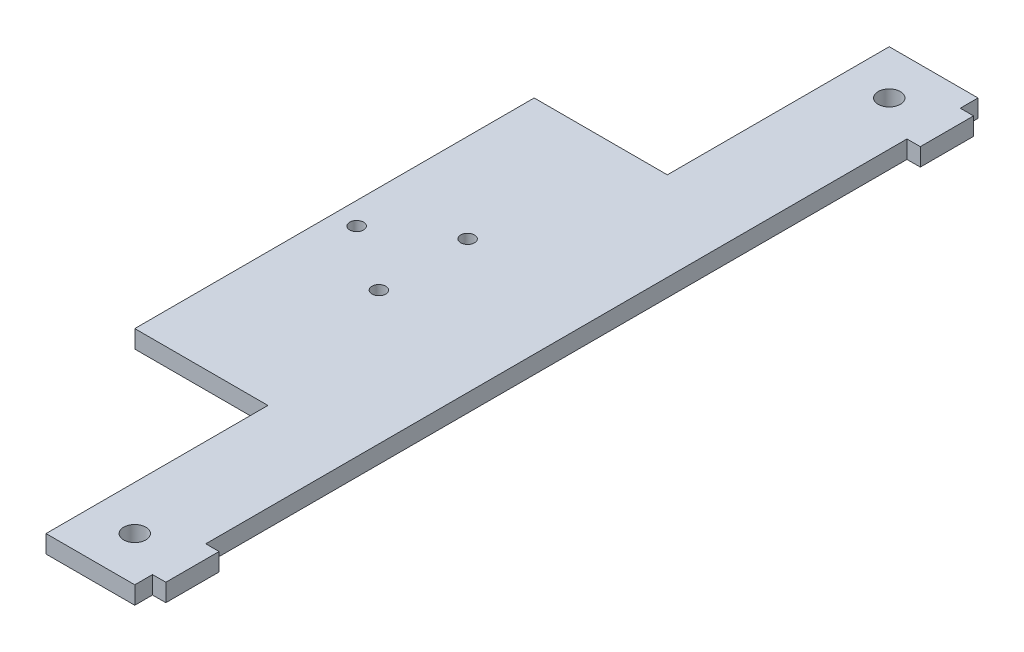
from build123d import *

# Parameters (mm, degrees)
CROQUIS1_W              = 250
CROQUIS1_H              = 250
CROQUIS1_R              = 2.5
SALIENTE_EXTRUIR1_DEPTH = 4
CORTAR_EXTRUIR1_DEPTH   = 4
CROQUIS3_W              = 150
CROQUIS3_H              = 150
CROQUIS3_W_2            = 100
CROQUIS3_H_2            = 100
SALIENTE_EXTRUIR2_DEPTH = 4
CROQUIS4_R              = 1.55
CORTAR_EXTRUIR2_DEPTH   = 10
CROQUIS5_W              = 150
CROQUIS5_H              = 150
CROQUIS5_W_2            = 100
CROQUIS5_H_2            = 100
CORTAR_EXTRUIR3_DEPTH   = 10
CROQUIS6_W              = 30
CROQUIS6_H              = 50
CROQUIS6_W_2            = 50
CROQUIS6_H_2            = 30
CORTAR_EXTRUIR4_DEPTH   = 10
CROQUIS8_R              = 1.55
CORTAR_EXTRUIR5_DEPTH   = 10
CORTAR_EXTRUIR6_DEPTH   = 10


with BuildPart() as part:
    # Croquis1 → Saliente-Extruir1 (new body)
    with BuildSketch(Plane(origin=(0, 0, 0), x_dir=(1, 0, 0), z_dir=(0, 1, 0))):
        with Locations((125, 125)):
            Rectangle(CROQUIS1_W, CROQUIS1_H)
        with Locations(Location((40, 210, 0), (0, 0, 270))):
            Circle(CROQUIS1_R, mode=Mode.SUBTRACT)
        with Locations(Location((210, 210, 0), (0, 0, 270))):
            Circle(CROQUIS1_R, mode=Mode.SUBTRACT)
        with Locations(Location((210, 40, 0), (0, 0, 270))):
            Circle(CROQUIS1_R, mode=Mode.SUBTRACT)
        with Locations(Location((40, 40, 0), (0, 0, 270))):
            Circle(CROQUIS1_R, mode=Mode.SUBTRACT)
    extrude(amount=SALIENTE_EXTRUIR1_DEPTH)

    # Croquis2 → Cortar-Extruir1 (cut)
    with BuildSketch(Plane(origin=(0, 4, 0), x_dir=(1, 0, 0), z_dir=(0, 1, 0))):
        Polygon((50, 50), (200, 50), (200, 200), (50, 200), (50, 150.09044268), align=None)
    extrude(amount=-CORTAR_EXTRUIR1_DEPTH, mode=Mode.SUBTRACT)

    # Croquis3 → Saliente-Extruir2 (add)
    with BuildSketch(Plane(origin=(0, 4, 0), x_dir=(1, 0, 0), z_dir=(0, 1, 0))):
        with Locations((125, 125)):
            Rectangle(CROQUIS3_W, CROQUIS3_H)
        with Locations((125, 125)):
            Rectangle(CROQUIS3_W_2, CROQUIS3_H_2, mode=Mode.SUBTRACT)
    extrude(amount=-SALIENTE_EXTRUIR2_DEPTH)

    # Croquis4 → Cortar-Extruir2 (cut)
    with BuildSketch(Plane(origin=(0, 4, 0), x_dir=(1, 0, 0), z_dir=(0, 1, 0))):
        with Locations(Location((115, 20, 0), (0, 0, 270))):
            Circle(CROQUIS4_R)
        with Locations(Location((135, 20, 0), (0, 0, 270))):
            Circle(CROQUIS4_R)
        with Locations(Location((125, 5, 0), (0, 0, 270))):
            Circle(CROQUIS4_R)
    extrude(amount=-CORTAR_EXTRUIR2_DEPTH, mode=Mode.SUBTRACT)

    # Croquis5 → Cortar-Extruir3 (cut)
    with BuildSketch(Plane(origin=(0, 4, 0), x_dir=(1, 0, 0), z_dir=(0, 1, 0))):
        with Locations((125, 125)):
            Rectangle(CROQUIS5_W, CROQUIS5_H)
        with Locations((125, 125)):
            Rectangle(CROQUIS5_W_2, CROQUIS5_H_2, mode=Mode.SUBTRACT)
    extrude(amount=-CORTAR_EXTRUIR3_DEPTH, mode=Mode.SUBTRACT)

    # Croquis6 → Cortar-Extruir4 (cut)
    with BuildSketch(Plane(origin=(0, 4, 0), x_dir=(1, 0, 0), z_dir=(0, 1, 0))):
        Polygon((170, 0), (250, 0), (250, 30), (220, 30), (170, 30), align=None)
        with Locations((235, 55)):
            Rectangle(CROQUIS6_W, CROQUIS6_H)
        Polygon((0, 80), (0, 0), (30, 0), (30, 30), (30, 80), align=None)
        with Locations((55, 15)):
            Rectangle(CROQUIS6_W_2, CROQUIS6_H_2)
        Polygon((80, 250), (0, 250), (0, 220), (30, 220), (80, 220), align=None)
        with Locations((15, 195)):
            Rectangle(CROQUIS6_W, CROQUIS6_H)
        Polygon((250, 170), (250, 250), (220, 250), (220, 220), (220, 170), align=None)
        with Locations((195, 235)):
            Rectangle(CROQUIS6_W_2, CROQUIS6_H_2)
    extrude(amount=-CORTAR_EXTRUIR4_DEPTH, mode=Mode.SUBTRACT)

    # Croquis8 → Cortar-Extruir5 (cut)
    with BuildSketch(Plane(origin=(0, 4, 0), x_dir=(1, 0, 0), z_dir=(0, 1, 0))):
        with Locations(Location((125, 5, 0), (0, 0, 270))):
            Circle(CROQUIS8_R)
        with Locations(Location((135, 20, 0), (0, 0, 270))):
            Circle(CROQUIS8_R)
        with Locations(Location((115, 20, 0), (0, 0, 270))):
            Circle(CROQUIS8_R)
        with Locations(Location((20, 135, 0), (0, 0, 270))):
            Circle(CROQUIS8_R)
        with Locations(Location((5, 125, 0), (0, 0, 270))):
            Circle(CROQUIS8_R)
        with Locations(Location((20, 115, 0), (0, 0, 270))):
            Circle(CROQUIS8_R)
        with Locations(Location((135, 230, 0), (0, 0, 270))):
            Circle(CROQUIS8_R)
        with Locations(Location((125, 245, 0), (0, 0, 270))):
            Circle(CROQUIS8_R)
        with Locations(Location((115, 230, 0), (0, 0, 270))):
            Circle(CROQUIS8_R)
        with Locations(Location((230, 115, 0), (0, 0, 270))):
            Circle(CROQUIS8_R)
        with Locations(Location((245, 125, 0), (0, 0, 270))):
            Circle(CROQUIS8_R)
        with Locations(Location((230, 135, 0), (0, 0, 270))):
            Circle(CROQUIS8_R)
    extrude(amount=-CORTAR_EXTRUIR5_DEPTH, mode=Mode.SUBTRACT)

    # Croquis9 → Cortar-Extruir6 (cut)
    with BuildSketch(Plane(origin=(0, 4, 0), x_dir=(1, 0, 0), z_dir=(0, 1, 0))):
        Polygon((50, 0), (250, 0), (250, 250), (50, 250), (50, 216), (53, 216), (53, 204), (50, 204), (50, 46), (53, 46), (53, 34), (50, 34), align=None)
    extrude(amount=-CORTAR_EXTRUIR6_DEPTH, mode=Mode.SUBTRACT)


solid = part.part
